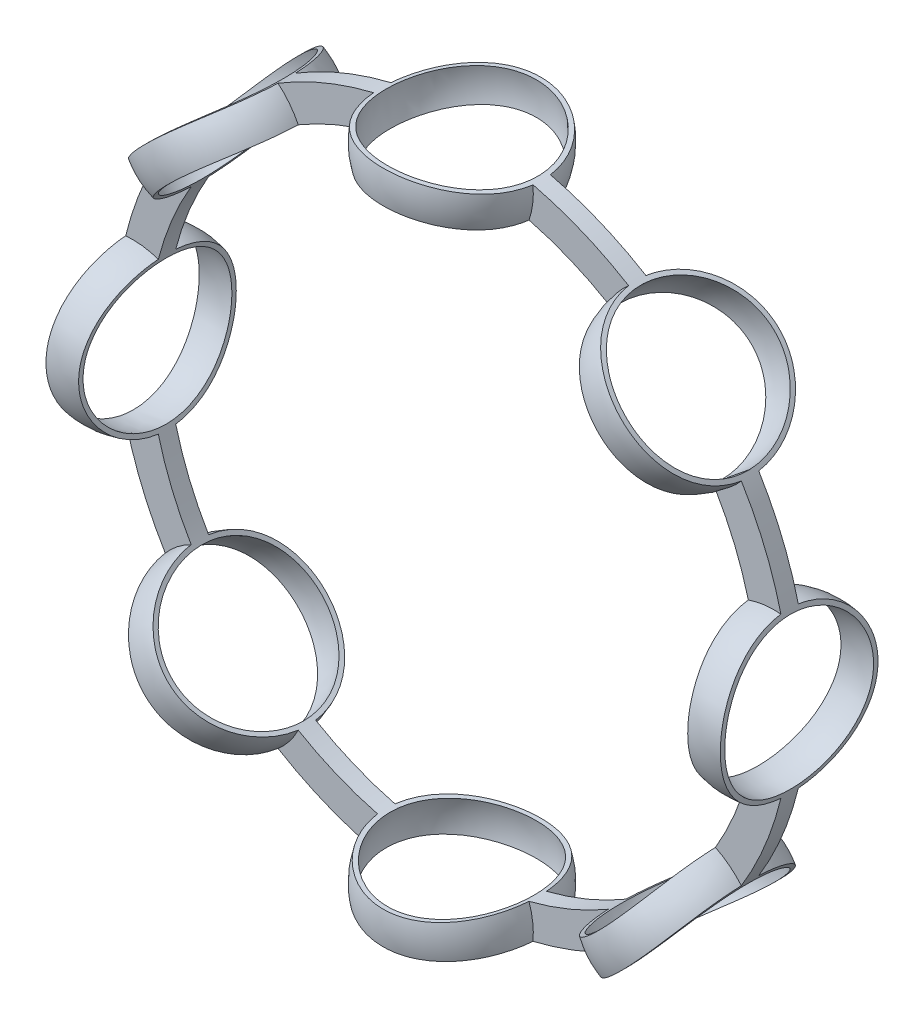
from build123d import *

# Parameters (mm, degrees)
SKETCH_1_R               = 90
EXTRUDE_1_DEPTH          = 2
PATTERN_CIRCULAR_1_COUNT = 8
SKETCH_5_OUTSIDE_W       = 239.206
SKETCH_5_OUTSIDE_H       = 239.206
SKETCH_5_OUTSIDE_R       = 77.5
SKETCH_5_OUTSIDE_R_2     = 70
CUT_EXTRUDE_1_DEPTH      = 35
PATTERN_CIRCULAR_2_COUNT = 8


with BuildPart() as part:
    # 草图1 → 拉伸1 (new, symmetric)
    with BuildSketch(Plane.XY):
        Circle(SKETCH_1_R)
    extrude(amount=EXTRUDE_1_DEPTH, both=True)

    # 草图4 → 旋转1 (revolve)
    with BuildSketch(Plane(origin=(0, 0, 0), x_dir=(1, 0, 0), z_dir=(0, 1, 0))):
        with BuildLine():
            Line((73.75, 18.5), (73.75, -18.5))
            ThreePointArc((73.75, -18.5), (92.25, 0), (73.75, 18.5))
        make_face()
    revolve_1 = revolve(axis=Axis((73.75, 0, -39.664192028), (0, 0, 1)))

    # 阵列(圆周)1: 旋转1 ×8 about axis
    pattern_circular_1_axis = Axis((0, 0, 0), (0, 0, 1))
    for i in range(1, PATTERN_CIRCULAR_1_COUNT):
        add(revolve_1.rotate(pattern_circular_1_axis, i * 360 / PATTERN_CIRCULAR_1_COUNT))

    # 草图5 outside → 切除-拉伸1 (cut, symmetric)
    # profile 1 of 2: a face of its own
    with BuildSketch(Plane.XY):
        Rectangle(SKETCH_5_OUTSIDE_W, SKETCH_5_OUTSIDE_H)
        with Locations(Location((0, 0, 0), (0, 0, 346.322061284))):
            Circle(SKETCH_5_OUTSIDE_R, mode=Mode.SUBTRACT)
    # profile 2 of 2: a face of its own
    with BuildSketch(Plane.XY):
        Circle(SKETCH_5_OUTSIDE_R_2)
    extrude(amount=CUT_EXTRUDE_1_DEPTH, both=True, mode=Mode.SUBTRACT)

    # 草图7 → 切除-旋转1 (revolve, cut)
    with BuildSketch(Plane(origin=(0, 0, 0), x_dir=(1, 0, 0), z_dir=(0, 1, 0))):
        with BuildLine():
            Line((73.75, 17.5), (73.75, -17.5))
            ThreePointArc((73.75, -17.5), (91.25, 0), (73.75, 17.5))
        make_face()
    cut_revolve_1 = revolve(axis=Axis((73.75, 0, -25.58024305), (0, 0, 1)), mode=Mode.SUBTRACT)

    # 阵列(圆周)2: 切除-旋转1 ×8 about axis
    pattern_circular_2_axis = Axis((0, 0, 0), (0, 0, 1))
    for i in range(1, PATTERN_CIRCULAR_2_COUNT):
        add(cut_revolve_1.rotate(pattern_circular_2_axis, i * 360 / PATTERN_CIRCULAR_2_COUNT), mode=Mode.SUBTRACT)


solid = part.part
